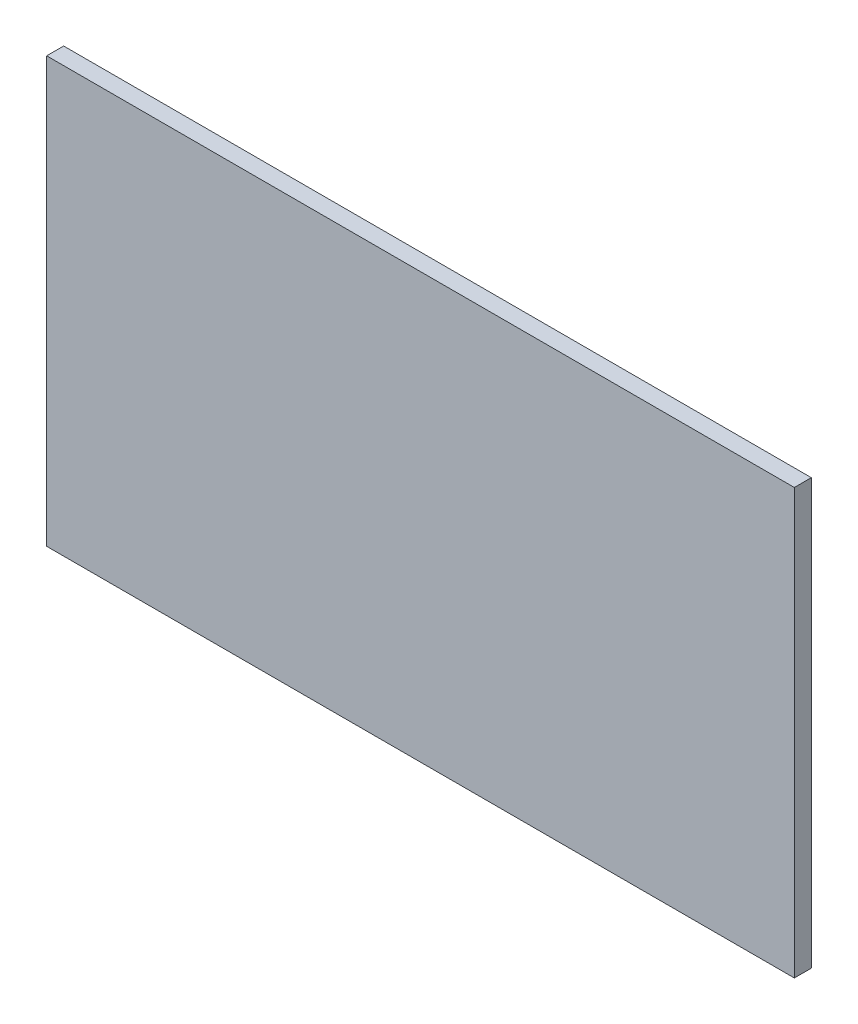
from build123d import *

# Parameters (mm, degrees)
SKETCH2_W           = 880
SKETCH2_H           = 500
BOSS_EXTRUDE1_DEPTH = 20


with BuildPart() as part:
    # Sketch2 → Boss-Extrude1 (new body)
    with BuildSketch(Plane.XY):
        with Locations((440, -250)):
            Rectangle(SKETCH2_W, SKETCH2_H)
    extrude(amount=BOSS_EXTRUDE1_DEPTH)


solid = part.part
